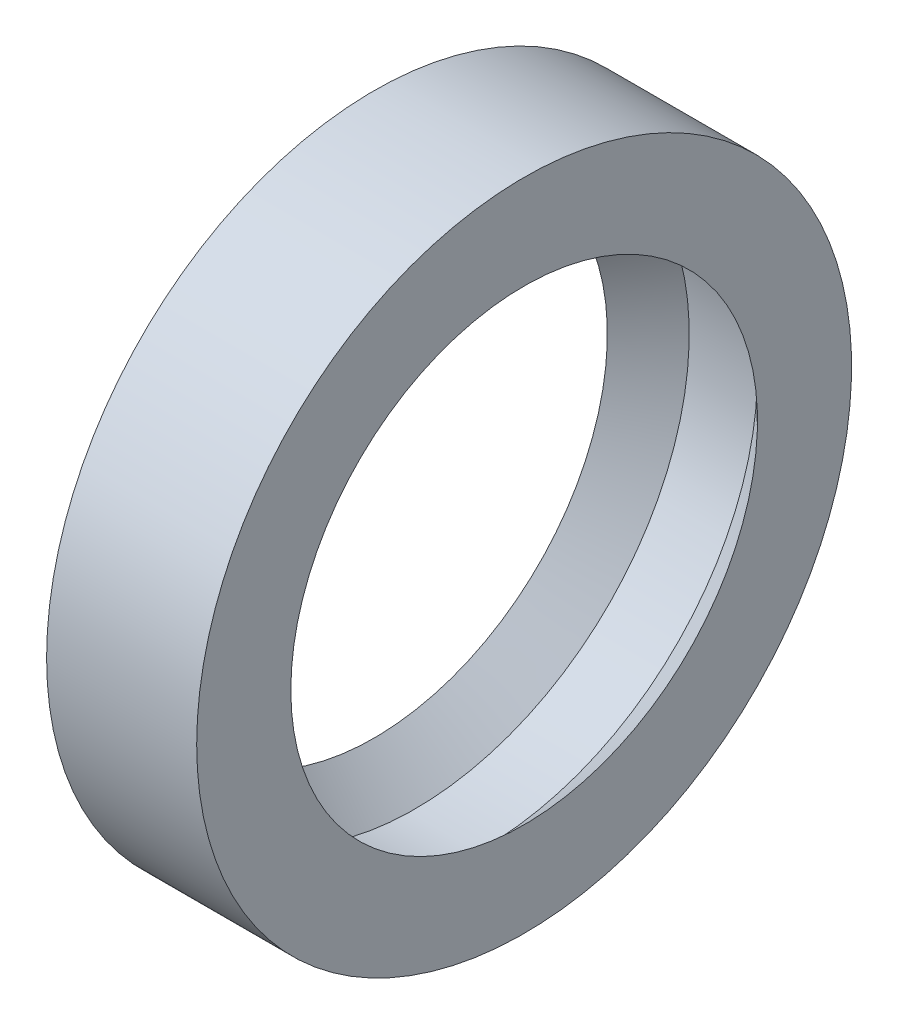
from build123d import *


with BuildPart() as part:
    # Axial profile (mm) → Full revolution (revolve)
    with BuildSketch(Plane.XY, mode=Mode.PRIVATE) as full_revolution_sk:
        Polygon((-5, 17.1), (-2, 20.1), (3, 20.1), (6, 17.1), (6, 24), (-5, 24), align=None)
    revolve(full_revolution_sk.sketch.rotate(Axis((-110, 0, 0), (1, 0, 0)), 90), axis=Axis((-110, 0, 0), (1, 0, 0)))


solid = part.part
